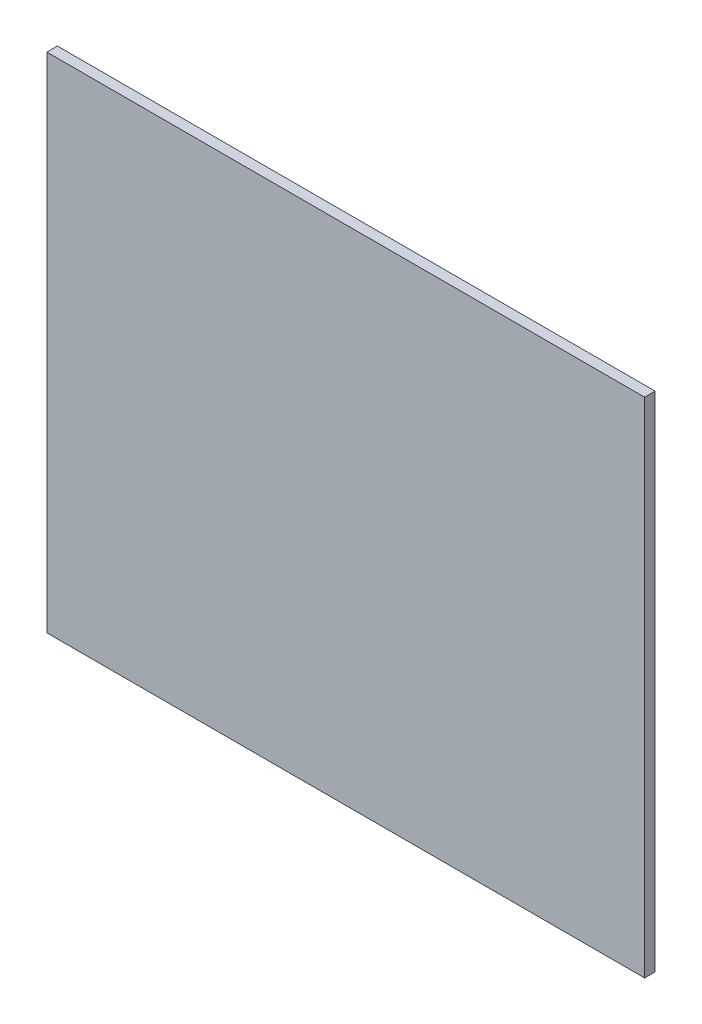
from build123d import *

# Parameters (mm, degrees)
SKETCH_1_W      = 568.661641695
SKETCH_1_H      = 478.442695945
EXTRUDE_1_DEPTH = 10


with BuildPart() as part:
    # 草图1 → 凸台-拉伸1 (new body)
    with BuildSketch(Plane.XY):
        with Locations((-42.43657046, 7.474657651)):
            Rectangle(SKETCH_1_W, SKETCH_1_H)
    extrude(amount=EXTRUDE_1_DEPTH)


solid = part.part
